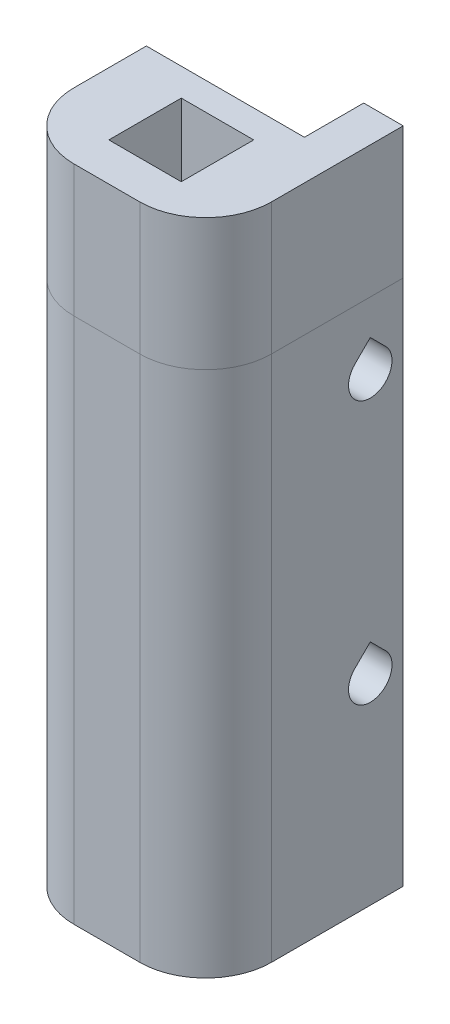
from build123d import *

# Parameters (mm, degrees)
SKETCH1_W              = 50
SKETCH1_H              = 15
BOSS_EXTRUDE1_DEPTH    = 15
SKETCH2_W              = 5.5
SKETCH2_H              = 5.5
SKETCH2_W_2            = 9
SKETCH2_H_2            = 4.5
CUT_EXTRUDE1_DEPTH     = 53.737557774
CUT_EXTRUDE2_DEPTH     = 33.787192622
FILLET1_R              = 5
SPLIT1_SURFACE_1_BACK  = 55.314
SPLIT1_SURFACE_1_DEPTH = 110.628
SPLIT1_SURFACE_2_BACK  = 55.314
SPLIT1_SURFACE_2_DEPTH = 110.628
SKETCH5_W              = 3
SKETCH5_H              = 4.5
CUT_EXTRUDE3_DEPTH     = 53.737557774


with BuildPart() as part:
    # Sketch1 → Boss-Extrude1 (new body)
    with BuildSketch(Plane(origin=(0, 0, 0), x_dir=(0, 1, 0), z_dir=(0, 0, 1))):
        Rectangle(SKETCH1_W, SKETCH1_H)
    extrude(amount=BOSS_EXTRUDE1_DEPTH)

    # Sketch2 → Cut-Extrude1 (cut, through all)
    with BuildSketch(Plane(origin=(0, 25, 0), x_dir=(-1, 0, 0), z_dir=(0, 1, 0))):
        with Locations((0, 9.35)):
            Rectangle(SKETCH2_W, SKETCH2_H)
        with Locations((0, 2.25)):
            Rectangle(SKETCH2_W_2, SKETCH2_H_2)
    extrude(amount=-CUT_EXTRUDE1_DEPTH, mode=Mode.SUBTRACT)

    # Sketch3 → Cut-Extrude2 (cut, through all)
    with BuildSketch(Plane.YZ.offset(7.5)):
        with BuildLine():
            Line((-7.677732328, 2.5), (-8.724768772, 3.547036444))
            ThreePointArc((-8.724768772, 3.547036444), (-11.65, 2.5), (-8.724768772, 1.452963556))
            Line((-8.724768772, 1.452963556), (-7.677732328, 2.5))
        make_face()
        with BuildLine():
            Line((11.166726189, 3.666726189), (12.333452378, 2.5))
            Line((12.333452378, 2.5), (11.166726189, 1.333273811))
            ThreePointArc((11.166726189, 1.333273811), (8.35, 2.5), (11.166726189, 3.666726189))
        make_face()
    extrude(amount=-CUT_EXTRUDE2_DEPTH, mode=Mode.SUBTRACT)

    # Fillet1
    fillet1_edges = [part.edges().sort_by_distance(p)[0] for p in [
        (7.5, 0, 15),
        (-7.5, 0, 15),
    ]]
    fillet(fillet1_edges, radius=FILLET1_R)


with BuildPart() as body_2:
    # Split1: the piece behind the surface
    add(part.part)
    # Split1 surface: a surface, the sketch's curves swept straight by 110.628 mm
    with BuildLine(Plane.XY.offset(15).offset(-SPLIT1_SURFACE_1_BACK), mode=Mode.PRIVATE) as split1_surface_1_path:
        Line((-7.5, 15), (7.5, 15))
    split1_surface_1 = Shell.extrude(split1_surface_1_path.wire(), (0 * SPLIT1_SURFACE_1_DEPTH, 0 * SPLIT1_SURFACE_1_DEPTH, 1 * SPLIT1_SURFACE_1_DEPTH))
    split(bisect_by=split1_surface_1, keep=Keep.BOTTOM)


with BuildPart() as part_1:
    add(part.part)

    # Split1: split by a surface, the side it looks to stays
    # Split1 surface: a surface, the sketch's curves swept straight by 110.628 mm
    with BuildLine(Plane.XY.offset(15).offset(-SPLIT1_SURFACE_2_BACK), mode=Mode.PRIVATE) as split1_surface_2_path:
        Line((-7.5, 15), (7.5, 15))
    split1_surface_2 = Shell.extrude(split1_surface_2_path.wire(), (0 * SPLIT1_SURFACE_2_DEPTH, 0 * SPLIT1_SURFACE_2_DEPTH, 1 * SPLIT1_SURFACE_2_DEPTH))
    split(bisect_by=split1_surface_2, keep=Keep.TOP)


with BuildPart() as cut_extrude3_tool:
    # Sketch5 → Cut-Extrude3 (new, through all)
    with BuildSketch(Plane(origin=(0, 25, 0), x_dir=(-1, 0, 0), z_dir=(0, 1, 0))):
        with Locations((6, 2.25)):
            Rectangle(SKETCH5_W, SKETCH5_H)
    extrude(amount=-CUT_EXTRUDE3_DEPTH)


with BuildPart() as part_2:
    add(part_1.part)

    # Cut-Extrude3: cut by cut_extrude3_tool
    add(cut_extrude3_tool.part, mode=Mode.SUBTRACT)


with BuildPart() as body_2_1:
    add(body_2.part)

    # Cut-Extrude3: cut by cut_extrude3_tool
    add(cut_extrude3_tool.part, mode=Mode.SUBTRACT)


solid = Compound([part_2.part, body_2_1.part])
